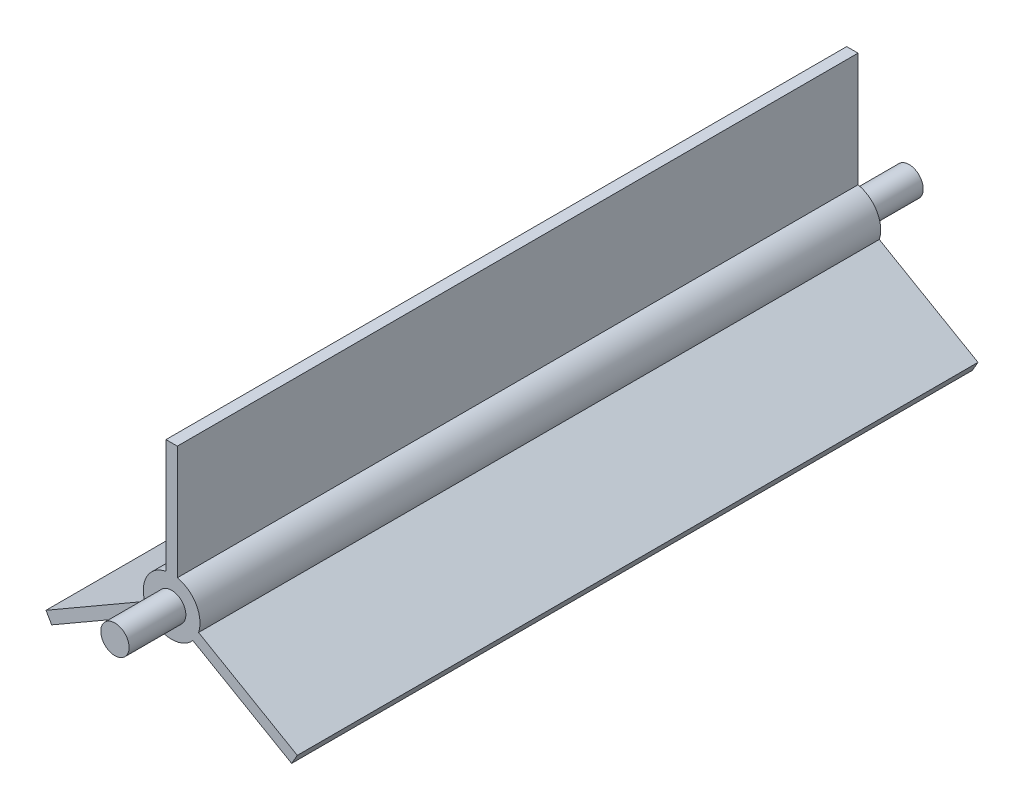
from build123d import *

# Parameters (mm, degrees)
BOSS_EXTRUDE1_DEPTH      = 304.8
BOSS_EXTRUDE2_DEPTH      = 25.4
BOSS_EXTRUDE2_DEPTH_BACK = 330.2
SKETCH2_R                = 6.35


with BuildPart() as part:
    # Sketch1 → Boss-Extrude1 (new body)
    with BuildSketch(Plane.XY):
        with BuildLine():
            Line((-2.54, 1.466469684), (-2.54, 12.443407893))
            ThreePointArc((-2.54, 12.443407893), (-10.998522628, 6.35), (-12.046307345, -4.021999421))
            Line((-12.046307345, -4.021999421), (-2.54, 1.466469684))
        make_face()
        with BuildLine():
            ThreePointArc((-9.506307345, -8.421408472), (0, -12.7), (9.506307345, -8.421408472))
            Line((9.506307345, -8.421408472), (0, -2.932939367))
            Line((0, -2.932939367), (-9.506307345, -8.421408472))
        make_face()
        with BuildLine():
            ThreePointArc((12.7, 0), (9.837377699, 8.032185257), (2.54, 12.443407893))
            Line((2.54, 12.443407893), (2.54, 1.466469684))
            Line((2.54, 1.466469684), (12.046307345, -4.021999421))
            ThreePointArc((12.046307345, -4.021999421), (12.535511623, -2.037387631), (12.7, 0))
        make_face()
        with BuildLine():
            Line((10.998522628, -6.35), (0, 0))
            Line((0, 0), (-10.998522628, -6.35))
            ThreePointArc((-10.998522628, -6.35), (-10.304595884, -7.423294665), (-9.506307345, -8.421408472))
            Line((-9.506307345, -8.421408472), (0, -2.932939367))
            Line((0, -2.932939367), (9.506307345, -8.421408472))
            ThreePointArc((9.506307345, -8.421408472), (10.304595884, -7.423294665), (10.998522628, -6.35))
        make_face()
        with BuildLine():
            Line((-10.998522628, -6.35), (0, 0))
            Line((0, 0), (0, 12.7))
            ThreePointArc((0, 12.7), (-1.276463817, 12.635689143), (-2.54, 12.443407893))
            Line((-2.54, 12.443407893), (-2.54, 1.466469684))
            Line((-2.54, 1.466469684), (-12.046307345, -4.021999421))
            ThreePointArc((-12.046307345, -4.021999421), (-11.581059701, -5.212394479), (-10.998522628, -6.35))
        make_face()
        with BuildLine():
            Line((0, 12.7), (0, 0))
            Line((0, 0), (10.998522628, -6.35))
            ThreePointArc((10.998522628, -6.35), (11.581059701, -5.212394479), (12.046307345, -4.021999421))
            Line((12.046307345, -4.021999421), (2.54, 1.466469684))
            Line((2.54, 1.466469684), (2.54, 12.443407893))
            ThreePointArc((2.54, 12.443407893), (1.276463817, 12.635689143), (0, 12.7))
        make_face()
        with BuildLine():
            Line((0, 63.5), (0, 12.7))
            ThreePointArc((0, 12.7), (1.276463817, 12.635689143), (2.54, 12.443407893))
            Line((2.54, 12.443407893), (2.54, 63.5))
            Line((2.54, 63.5), (0, 63.5))
        make_face()
        with BuildLine():
            ThreePointArc((-2.54, 12.443407893), (-1.276463817, 12.635689143), (0, 12.7))
            Line((0, 12.7), (0, 63.5))
            Line((0, 63.5), (-2.54, 63.5))
            Line((-2.54, 63.5), (-2.54, 12.443407893))
        make_face()
        with BuildLine():
            Line((-54.99261314, -31.75), (-10.998522628, -6.35))
            ThreePointArc((-10.998522628, -6.35), (-11.581059701, -5.212394479), (-12.046307345, -4.021999421))
            Line((-12.046307345, -4.021999421), (-56.26261314, -29.550295474))
            Line((-56.26261314, -29.550295474), (-54.99261314, -31.75))
        make_face()
        with BuildLine():
            ThreePointArc((-9.506307345, -8.421408472), (-10.304595884, -7.423294665), (-10.998522628, -6.35))
            Line((-10.998522628, -6.35), (-54.99261314, -31.75))
            Line((-54.99261314, -31.75), (-53.72261314, -33.949704526))
            Line((-53.72261314, -33.949704526), (-9.506307345, -8.421408472))
        make_face()
        with BuildLine():
            Line((54.99261314, -31.75), (10.998522628, -6.35))
            ThreePointArc((10.998522628, -6.35), (10.304595884, -7.423294665), (9.506307345, -8.421408472))
            Line((9.506307345, -8.421408472), (53.72261314, -33.949704526))
            Line((53.72261314, -33.949704526), (54.99261314, -31.75))
        make_face()
        with BuildLine():
            ThreePointArc((12.046307345, -4.021999421), (11.581059701, -5.212394479), (10.998522628, -6.35))
            Line((10.998522628, -6.35), (54.99261314, -31.75))
            Line((54.99261314, -31.75), (56.26261314, -29.550295474))
            Line((56.26261314, -29.550295474), (12.046307345, -4.021999421))
        make_face()
    extrude(amount=BOSS_EXTRUDE1_DEPTH)

    # Sketch2 → Boss-Extrude2 (add, two sides: drawn at the far end of the back side and taken through both)
    with BuildSketch(Plane.XY.offset(304.8).offset(-BOSS_EXTRUDE2_DEPTH_BACK)):
        Circle(SKETCH2_R)
    extrude(amount=BOSS_EXTRUDE2_DEPTH + BOSS_EXTRUDE2_DEPTH_BACK)


solid = part.part
